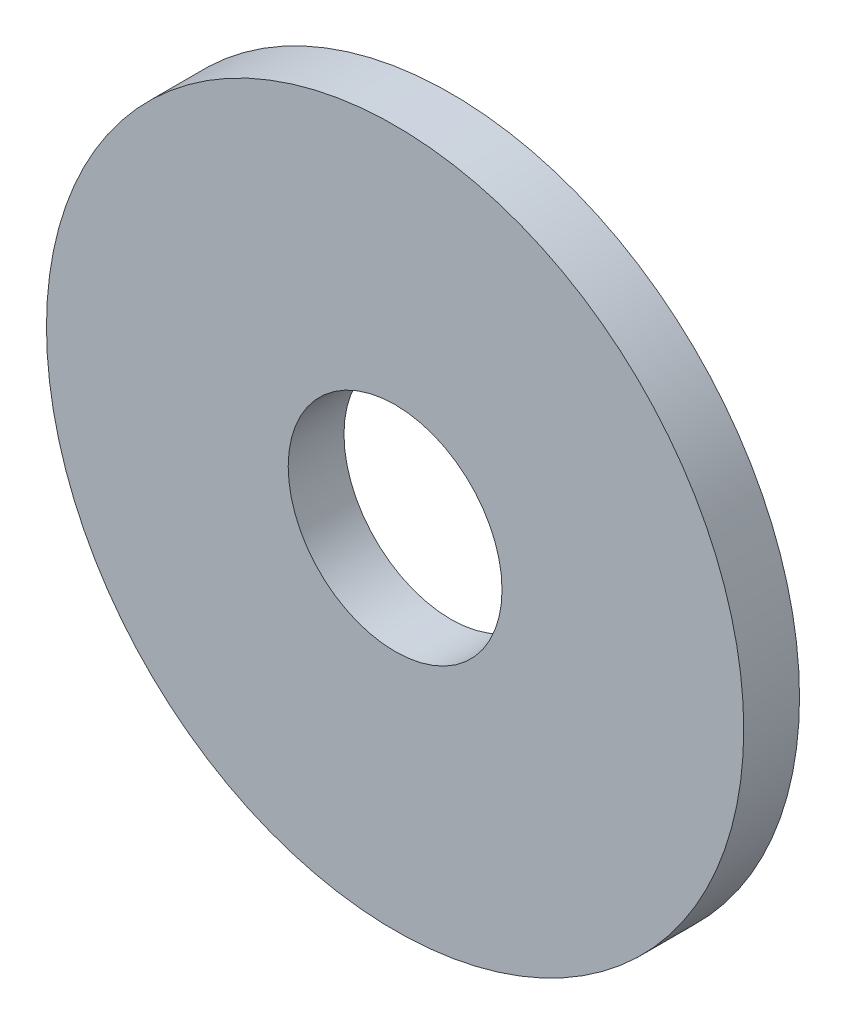
from build123d import *

# Parameters (mm, degrees)
CROQUIS1_R              = 7.5
CROQUIS1_R_2            = 2.3
SALIENTE_EXTRUIR1_DEPTH = 1.2


with BuildPart() as part:
    # Croquis1 → Saliente-Extruir1 (new body)
    with BuildSketch(Plane.XY):
        Circle(CROQUIS1_R)
        Circle(CROQUIS1_R_2, mode=Mode.SUBTRACT)
    extrude(amount=SALIENTE_EXTRUIR1_DEPTH)


solid = part.part
